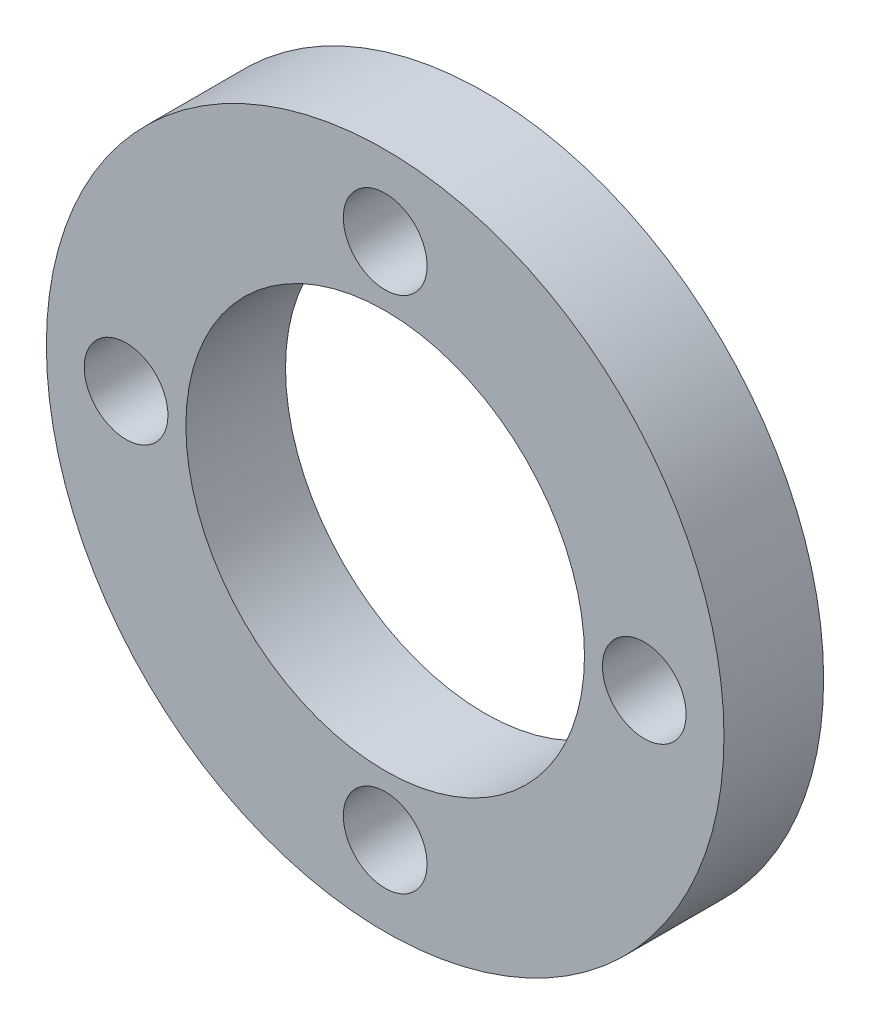
from build123d import *

# Parameters (mm, degrees)
ESQUISSE1_R                  = 17
ESQUISSE1_R_2                = 10
EXTRUSION1_DEPTH             = 5
ESQUISSE2_R                  = 2.1
ENL_V_MAT_EXTRU_1_DEPTH      = 25.556058316
R_P_TITION_CIRCULAIRE1_COUNT = 4


with BuildPart() as part:
    # Esquisse1 → Extrusion1 (new body)
    with BuildSketch(Plane.XY):
        Circle(ESQUISSE1_R)
        Circle(ESQUISSE1_R_2, mode=Mode.SUBTRACT)
    extrude(amount=EXTRUSION1_DEPTH)

    # Esquisse2 → Enlèv. mat.-Extru.1 (cut, through all)
    with BuildSketch(Plane.XY.offset(5)):
        with Locations((0, 13)):
            Circle(ESQUISSE2_R)
    enl_v_mat_extru_1 = extrude(amount=-ENL_V_MAT_EXTRU_1_DEPTH, mode=Mode.SUBTRACT)

    # Répétition circulaire1: Enlèv. mat.-Extru.1 ×4 about axis
    r_p_tition_circulaire1_axis = Axis((0, 0, 5), (0, 0, -1))
    for i in range(1, R_P_TITION_CIRCULAIRE1_COUNT):
        add(enl_v_mat_extru_1.rotate(r_p_tition_circulaire1_axis, i * 360 / R_P_TITION_CIRCULAIRE1_COUNT), mode=Mode.SUBTRACT)


solid = part.part
